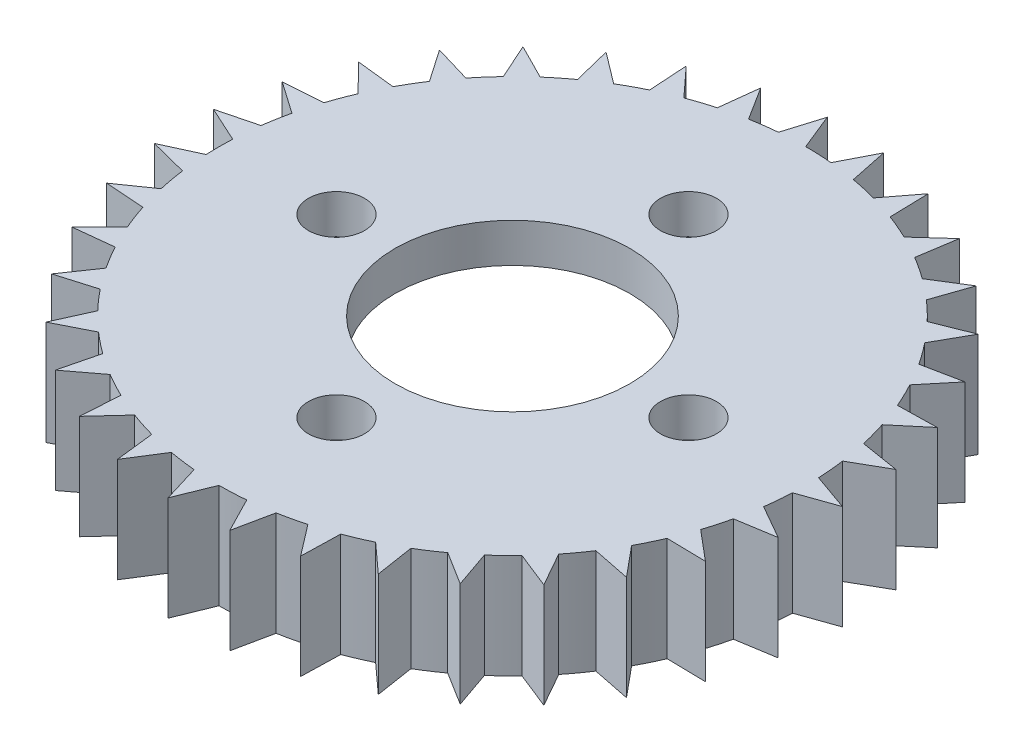
from build123d import *

# Parameters (mm, degrees)
SKETCH1_R           = 18
SKETCH1_R_2         = 9
SKETCH1_R_3         = 2.15
BOSS_EXTRUDE1_DEPTH = 3
BOSS_EXTRUDE2_START = -8
SKETCH2_R           = 18
BOSS_EXTRUDE2_DEPTH = 8


with BuildPart() as part:
    # Sketch1 → Boss-Extrude1 (new body)
    with BuildSketch(Plane(origin=(0, 0, 0), x_dir=(1, 0, 0), z_dir=(0, 1, 0))):
        with Locations(Location((0, 0, 0), (0, 0, 270))):
            Circle(SKETCH1_R)
        with Locations(Location((0, 0, 0), (0, 0, 270))):
            Circle(SKETCH1_R_2, mode=Mode.SUBTRACT)
        with Locations(Location((0, -13.5, 0), (0, 0, 270))):
            Circle(SKETCH1_R_3, mode=Mode.SUBTRACT)
        with Locations(Location((-13.5, 0, 0), (0, 0, 270))):
            Circle(SKETCH1_R_3, mode=Mode.SUBTRACT)
        with Locations(Location((0, 13.5, 0), (0, 0, 270))):
            Circle(SKETCH1_R_3, mode=Mode.SUBTRACT)
        with Locations(Location((13.5, 0, 0), (0, 0, 270))):
            Circle(SKETCH1_R_3, mode=Mode.SUBTRACT)
    extrude(amount=BOSS_EXTRUDE1_DEPTH)

    # Sketch2 → Boss-Extrude2 (add)
    with BuildSketch(Plane(origin=(0, 3, 0), x_dir=(1, 0, 0), z_dir=(0, 1, 0)).offset(BOSS_EXTRUDE2_START)):
        with BuildLine():
            Line((22.477766793, 1), (25.306193918, 0))
            Line((25.306193918, 0), (22.477766793, -1))
            ThreePointArc((22.477766793, -1), (22.409421615, -2.01688445), (22.295096728, -3.029630652))
            Line((22.295096728, -3.029630652), (24.89951297, -4.518595405))
            Line((24.89951297, -4.518595405), (21.937982938, -4.997489829))
            ThreePointArc((21.937982938, -4.997489829), (21.689164366, -5.985829025), (21.39584391, -6.961886482))
            Line((21.39584391, -6.961886482), (23.692541189, -8.891959436))
            Line((23.692541189, -8.891959436), (20.693094262, -8.834356223))
            ThreePointArc((20.693094262, -8.834356223), (20.271799528, -9.76238413), (19.808911064, -10.670381552))
            Line((19.808911064, -10.670381552), (21.724071639, -12.979528574))
            Line((21.724071639, -12.979528574), (18.783112509, -12.387279139))
            ThreePointArc((18.783112509, -12.387279139), (18.202882373, -13.225168177), (17.585303517, -14.03592178))
            Line((17.585303517, -14.03592178), (19.057372553, -16.649924985))
            Line((19.057372553, -16.649924985), (16.269426065, -15.542064712))
            ThreePointArc((16.269426065, -15.542064712), (15.548909602, -16.262884436), (14.796489846, -16.950335932))
            Line((14.796489846, -16.950335932), (15.778153832, -19.785179106))
            Line((15.778153832, -19.785179106), (13.232826882, -18.197315536))
            ThreePointArc((13.232826882, -18.197315536), (12.395182083, -18.777898209), (11.532104817, -19.319952342))
            Line((11.532104817, -19.319952342), (11.991812264, -22.284521292))
            Line((11.991812264, -22.284521292), (9.770913754, -20.267689666))
            ThreePointArc((9.770913754, -20.267689666), (8.843063212, -20.689374882), (7.897068451, -21.068609586))
            Line((7.897068451, -21.068609586), (7.820043984, -24.067620628))
            Line((7.820043984, -24.067620628), (5.994955418, -21.686643575))
            ThreePointArc((5.994955418, -21.686643575), (5.006721014, -21.935878024), (4.008213807, -22.140104383))
            Line((4.008213807, -22.140104383), (3.396933055, -25.077166834))
            Line((3.396933055, -25.077166834), (2.026314283, -22.408570914))
            ThreePointArc((2.026314283, -22.408570914), (1.009458683, -22.477343997), (-0.009468127, -22.499998008))
            Line((-0.009468127, -22.499998008), (-1.135358097, -25.280712264))
            Line((-1.135358097, -25.280712264), (-2.00745426, -22.410268347))
            ThreePointArc((-2.00745426, -22.410268347), (-3.020248481, -22.29636964), (-4.026845748, -22.136723184))
            Line((-4.026845748, -22.136723184), (-5.631157905, -24.671714801))
            Line((-5.631157905, -24.671714801), (-5.976701572, -21.691681316))
            ThreePointArc((-5.976701572, -21.691681316), (-6.952882373, -21.398771617), (-7.914797233, -21.061955863))
            Line((-7.914797233, -21.061955863), (-9.945967666, -23.269748125))
            Line((-9.945967666, -23.269748125), (-9.753852778, -20.275905799))
            ThreePointArc((-9.753852778, -20.275905799), (-10.662044906, -19.813399467), (-11.548360622, -19.31023995))
            Line((-11.548360622, -19.31023995), (-13.941105841, -21.119872597))
            Line((-13.941105841, -21.119872597), (-13.21750713, -18.208445987))
            ThreePointArc((-13.21750713, -18.208445987), (-14.028520542, -17.591208356), (-14.810750199, -16.937877037))
            Line((-14.810750199, -16.937877037), (-17.488165405, -18.291186987))
            Line((-17.488165405, -18.291186987), (-16.256339927, -15.555751739))
            ThreePointArc((-16.256339927, -15.555751739), (-16.944107985, -14.803621334), (-17.597110079, -14.02111682))
            Line((-17.597110079, -14.02111682), (-20.473140942, -14.874607576))
            Line((-20.473140942, -14.874607576), (-18.772680583, -12.403082831))
            ThreePointArc((-18.772680583, -12.403082831), (-19.315097856, -11.540233742), (-19.817884361, -10.653706371))
            Line((-19.817884361, -10.653706371), (-22.800092885, -10.97994604))
            Line((-22.800092885, -10.97994604), (-20.68565184, -8.851768635))
            ThreePointArc((-20.68565184, -8.851768635), (-21.065284589, -7.905933542), (-21.401695534, -6.943877034))
            Line((-21.401695534, -6.943877034), (-24.394231082, -6.732380003))
            Line((-24.394231082, -6.732380003), (-21.933769225, -5.015951312))
            ThreePointArc((-21.933769225, -5.015951312), (-22.138415743, -4.017530133), (-22.297638603, -3.010865775))
            Line((-22.297638603, -3.010865775), (-25.204318621, -2.268429734))
            Line((-25.204318621, -2.268429734), (-22.476917221, -1.018917187))
            ThreePointArc((-22.476917221, -1.018917187), (-22.5, 0), (-22.476917221, 1.018917187))
            Line((-22.476917221, 1.018917187), (-25.204318621, 2.268429734))
            Line((-25.204318621, 2.268429734), (-22.297638603, 3.010865775))
            ThreePointArc((-22.297638603, 3.010865775), (-22.138415743, 4.017530133), (-21.933769225, 5.015951312))
            Line((-21.933769225, 5.015951312), (-24.394231082, 6.732380003))
            Line((-24.394231082, 6.732380003), (-21.401695534, 6.943877034))
            ThreePointArc((-21.401695534, 6.943877034), (-21.065284589, 7.905933542), (-20.68565184, 8.851768635))
            Line((-20.68565184, 8.851768635), (-22.800092885, 10.97994604))
            Line((-22.800092885, 10.97994604), (-19.817884361, 10.653706371))
            ThreePointArc((-19.817884361, 10.653706371), (-19.315097856, 11.540233742), (-18.772680583, 12.403082831))
            Line((-18.772680583, 12.403082831), (-20.473140942, 14.874607576))
            Line((-20.473140942, 14.874607576), (-17.597110079, 14.02111682))
            ThreePointArc((-17.597110079, 14.02111682), (-16.944107985, 14.803621334), (-16.256339927, 15.555751739))
            Line((-16.256339927, 15.555751739), (-17.488165405, 18.291186987))
            Line((-17.488165405, 18.291186987), (-14.810750199, 16.937877037))
            ThreePointArc((-14.810750199, 16.937877037), (-14.028520542, 17.591208356), (-13.21750713, 18.208445987))
            Line((-13.21750713, 18.208445987), (-13.941105841, 21.119872597))
            Line((-13.941105841, 21.119872597), (-11.548360622, 19.31023995))
            ThreePointArc((-11.548360622, 19.31023995), (-10.662044906, 19.813399467), (-9.753852778, 20.275905799))
            Line((-9.753852778, 20.275905799), (-9.945967666, 23.269748125))
            Line((-9.945967666, 23.269748125), (-7.914797233, 21.061955863))
            ThreePointArc((-7.914797233, 21.061955863), (-6.952882373, 21.398771617), (-5.976701572, 21.691681316))
            Line((-5.976701572, 21.691681316), (-5.631157905, 24.671714801))
            Line((-5.631157905, 24.671714801), (-4.026845748, 22.136723184))
            ThreePointArc((-4.026845748, 22.136723184), (-3.020248481, 22.29636964), (-2.00745426, 22.410268347))
            Line((-2.00745426, 22.410268347), (-1.135358097, 25.280712264))
            Line((-1.135358097, 25.280712264), (-0.009468127, 22.499998008))
            ThreePointArc((-0.009468127, 22.499998008), (1.009458683, 22.477343997), (2.026314283, 22.408570914))
            Line((2.026314283, 22.408570914), (3.396933055, 25.077166834))
            Line((3.396933055, 25.077166834), (4.008213807, 22.140104383))
            ThreePointArc((4.008213807, 22.140104383), (5.006721014, 21.935878024), (5.994955418, 21.686643575))
            Line((5.994955418, 21.686643575), (7.820043984, 24.067620628))
            Line((7.820043984, 24.067620628), (7.897068451, 21.068609586))
            ThreePointArc((7.897068451, 21.068609586), (8.843063212, 20.689374882), (9.770913754, 20.267689666))
            Line((9.770913754, 20.267689666), (11.991812264, 22.284521292))
            Line((11.991812264, 22.284521292), (11.532104817, 19.319952342))
            ThreePointArc((11.532104817, 19.319952342), (12.395182083, 18.777898209), (13.232826882, 18.197315536))
            Line((13.232826882, 18.197315536), (15.778153832, 19.785179106))
            Line((15.778153832, 19.785179106), (14.796489846, 16.950335932))
            ThreePointArc((14.796489846, 16.950335932), (15.548909602, 16.262884436), (16.269426065, 15.542064712))
            Line((16.269426065, 15.542064712), (19.057372553, 16.649924985))
            Line((19.057372553, 16.649924985), (17.585303517, 14.03592178))
            ThreePointArc((17.585303517, 14.03592178), (18.202882373, 13.225168177), (18.783112509, 12.387279139))
            Line((18.783112509, 12.387279139), (21.724071639, 12.979528574))
            Line((21.724071639, 12.979528574), (19.808911064, 10.670381552))
            ThreePointArc((19.808911064, 10.670381552), (20.271799528, 9.76238413), (20.693094262, 8.834356223))
            Line((20.693094262, 8.834356223), (23.692541189, 8.891959436))
            Line((23.692541189, 8.891959436), (21.39584391, 6.961886482))
            ThreePointArc((21.39584391, 6.961886482), (21.689164366, 5.985829025), (21.937982938, 4.997489829))
            Line((21.937982938, 4.997489829), (24.89951297, 4.518595405))
            Line((24.89951297, 4.518595405), (22.295096728, 3.029630652))
            ThreePointArc((22.295096728, 3.029630652), (22.409421615, 2.01688445), (22.477766793, 1))
        make_face()
        with Locations(Location((0, 0, 0), (0, 0, 270))):
            Circle(SKETCH2_R, mode=Mode.SUBTRACT)
    extrude(amount=BOSS_EXTRUDE2_DEPTH)


solid = part.part
